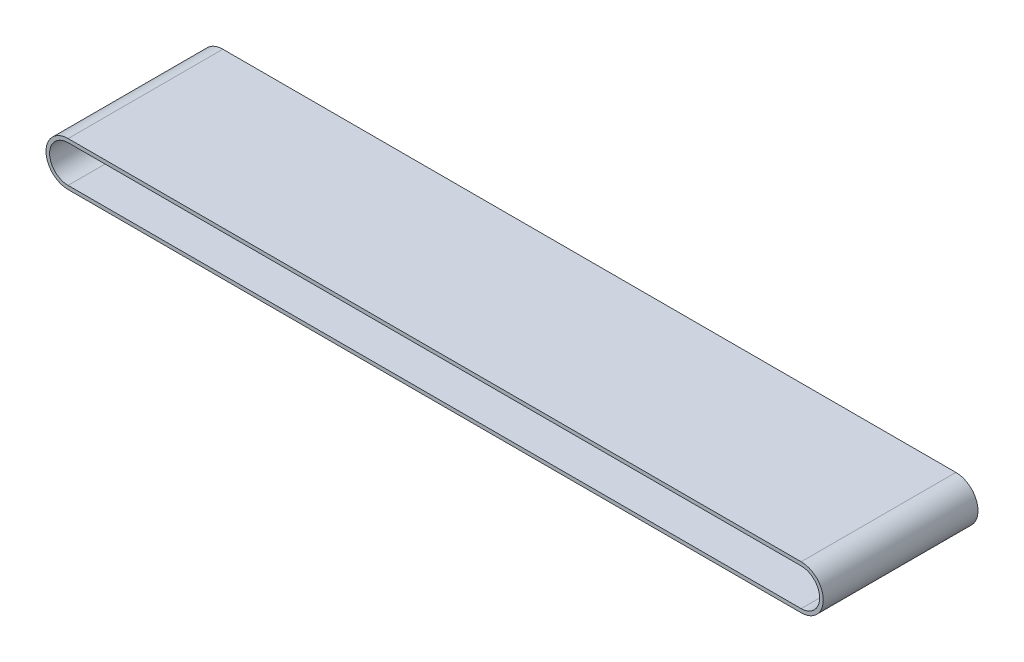
from build123d import *

# Parameters (mm, degrees)
BOSS_EXTRUDE1_DEPTH = 1067


with BuildPart() as part:
    # Sketch1 → Boss-Extrude1 (new body)
    with BuildSketch(Plane.XY):
        with BuildLine():
            Line((-2517.43024211, 25), (2537.56975789, 25))
            ThreePointArc((2537.56975789, 25), (2690.06975789, -127.5), (2537.56975789, -280))
            Line((2537.56975789, -280), (-2517.43024211, -280))
            ThreePointArc((-2517.43024211, -280), (-2669.93024211, -127.5), (-2517.43024211, 25))
        make_face()
        with BuildLine():
            Line((-2517.43024211, 0), (2537.56975789, 0))
            ThreePointArc((2537.56975789, 0), (2665.06975789, -127.5), (2537.56975789, -255))
            Line((2537.56975789, -255), (-2517.43024211, -255))
            ThreePointArc((-2517.43024211, -255), (-2644.93024211, -127.5), (-2517.43024211, 0))
        make_face(mode=Mode.SUBTRACT)
    extrude(amount=BOSS_EXTRUDE1_DEPTH)


solid = part.part
